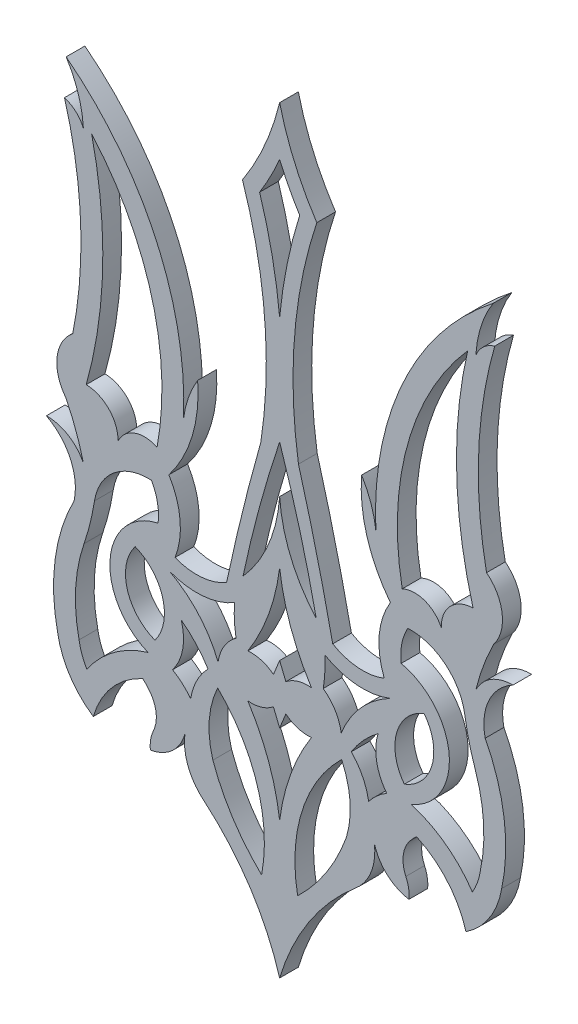
from build123d import *

# Parameters (mm, degrees)
EXTRUDE_1_DEPTH     = 6
CUT_EXTRUDE_4_DEPTH = 10
SCALE_1_SCALE       = 0.5


with BuildPart() as part:
    # Эскиз3 → Бобышка-Вытянуть1 (new body)
    with BuildSketch(Plane.XY):
        with BuildLine():
            ThreePointArc((75.737298173, 214.827117189), (82.873597213, 227.992034462), (87.644341315, 242.186463353))
            ThreePointArc((87.644341315, 242.186463353), (92.415085417, 227.992034462), (99.551384458, 214.827117189))
            ThreePointArc((99.551384458, 214.827117189), (92.448615199, 180.200274987), (93.683201055, 144.874033612))
            ThreePointArc((93.683201055, 144.874033612), (99.543941176, 122.77181273), (104.650975019, 100.483370703))
            ThreePointArc((104.650975019, 100.483370703), (112.761124808, 97.943619496), (121.169223706, 99.180041243))
            ThreePointArc((121.169223706, 99.180041243), (119.549894236, 110.406048742), (123.14170404, 121.164504703))
            ThreePointArc((123.14170404, 121.164504703), (115.644359384, 135.701433483), (113.915816321, 151.966261))
            ThreePointArc((113.915816321, 151.966261), (116.901405678, 145.64272451), (118.481996173, 138.830779763))
            ThreePointArc((118.481996173, 138.830779763), (127.24668609, 184.362661976), (156.055436754, 220.69485118))
            ThreePointArc((156.055436754, 220.69485118), (152.204137163, 212.503983736), (150.529344239, 203.609160148))
            ThreePointArc((150.529344239, 203.609160148), (152.949885488, 207.021489641), (156.580265974, 209.100756347))
            ThreePointArc((156.580265974, 209.100756347), (151.4198282, 177.15256964), (153.948768597, 144.889259016))
            ThreePointArc((153.948768597, 144.889259016), (158.962764238, 135.949313763), (156.186698644, 126.082387532))
            ThreePointArc((156.186698644, 126.082387532), (152.918092332, 118.533010155), (150.508133779, 110.667326092))
            ThreePointArc((150.508133779, 110.667326092), (155.402709379, 116.006658411), (162.390479703, 117.913594648))
            ThreePointArc((162.390479703, 117.913594648), (154.707516768, 109.824907217), (153.507722785, 98.733681937))
            ThreePointArc((153.507722785, 98.733681937), (159.570043449, 79.653195004), (158.80328853, 59.647475814))
            ThreePointArc((158.80328853, 59.647475814), (154.917566842, 49.613113406), (147.358546899, 41.95488388))
            ThreePointArc((147.358546899, 41.95488388), (141.45972495, 52.906488134), (131.532504975, 60.402089491))
            ThreePointArc((131.532504975, 60.402089491), (130.313453485, 59.224360677), (129.217982636, 57.930886552))
            ThreePointArc((129.217982636, 57.930886552), (127.222488275, 52.953447096), (128.085354098, 47.660776328))
            ThreePointArc((128.085354098, 47.660776328), (128.974997774, 44.792014096), (129.083146931, 41.790420124))
            ThreePointArc((129.083146931, 41.790420124), (122.02961795, 45.187826335), (117.983840441, 51.890536563))
            ThreePointArc((117.983840441, 51.890536563), (116.942345618, 43.244180813), (111.79351299, 36.220385415))
            ThreePointArc((111.79351299, 36.220385415), (97.034028223, 19.487966284), (87.644341315, -0.751846469))
            ThreePointArc((87.644341315, -0.751846469), (78.254654407, 19.487966284), (63.495169641, 36.220385415))
            ThreePointArc((63.495169641, 36.220385415), (58.346337012, 43.244180813), (57.30484219, 51.890536563))
            ThreePointArc((57.30484219, 51.890536563), (53.25906468, 45.187826335), (46.205535699, 41.790420124))
            ThreePointArc((46.205535699, 41.790420124), (46.313684857, 44.792014096), (47.203328533, 47.660776328))
            ThreePointArc((47.203328533, 47.660776328), (48.066194355, 52.953447096), (46.070699995, 57.930886552))
            ThreePointArc((46.070699995, 57.930886552), (44.975229145, 59.224360677), (43.756177656, 60.402089491))
            ThreePointArc((43.756177656, 60.402089491), (33.828957681, 52.906488134), (27.930135731, 41.95488388))
            ThreePointArc((27.930135731, 41.95488388), (20.371115788, 49.613113406), (16.4853941, 59.647475814))
            ThreePointArc((16.4853941, 59.647475814), (15.718639182, 79.653195004), (21.780959845, 98.733681937))
            ThreePointArc((21.780959845, 98.733681937), (20.581165862, 109.824907217), (12.898202928, 117.913594648))
            ThreePointArc((12.898202928, 117.913594648), (19.885973252, 116.006658411), (24.780548852, 110.667326092))
            ThreePointArc((24.780548852, 110.667326092), (22.370590299, 118.533010155), (19.101983986, 126.082387532))
            ThreePointArc((19.101983986, 126.082387532), (16.325918393, 135.949313763), (21.339914033, 144.889259016))
            ThreePointArc((21.339914033, 144.889259016), (23.868854431, 177.15256964), (18.708416657, 209.100756347))
            ThreePointArc((18.708416657, 209.100756347), (22.338797143, 207.021489641), (24.759338391, 203.609160148))
            ThreePointArc((24.759338391, 203.609160148), (23.084545467, 212.503983736), (19.233245877, 220.69485118))
            ThreePointArc((19.233245877, 220.69485118), (48.041996541, 184.362661976), (56.806686458, 138.830779763))
            ThreePointArc((56.806686458, 138.830779763), (58.387276952, 145.64272451), (61.37286631, 151.966261))
            ThreePointArc((61.37286631, 151.966261), (59.644323247, 135.701433483), (52.14697859, 121.164504703))
            ThreePointArc((52.14697859, 121.164504703), (55.738788395, 110.406048742), (54.119458925, 99.180041243))
            ThreePointArc((54.119458925, 99.180041243), (62.527557822, 97.943619496), (70.637707612, 100.483370703))
            ThreePointArc((70.637707612, 100.483370703), (75.744741455, 122.77181273), (81.605481576, 144.874033612))
            ThreePointArc((81.605481576, 144.874033612), (82.840067432, 180.200274987), (75.737298173, 214.827117189))
        make_face()
    extrude(amount=EXTRUDE_1_DEPTH)

    # Эскиз4 → Вырез-Вытянуть4 (cut)
    with BuildSketch(Plane.XY):
        with BuildLine():
            Line((85.654622356, 73.518555252), (87.644341315, 68.631836287))
            Line((87.644341315, 68.631836287), (89.634060275, 73.518555252))
            ThreePointArc((89.634060275, 73.518555252), (93.498316524, 71.48652915), (97.84617103, 71.089329421))
            ThreePointArc((97.84617103, 71.089329421), (91.177891627, 57.600515287), (87.644341315, 42.974234859))
            ThreePointArc((87.644341315, 42.974234859), (84.110791004, 57.600515287), (77.442511601, 71.089329421))
            ThreePointArc((77.442511601, 71.089329421), (81.790366107, 71.48652915), (85.654622356, 73.518555252))
        make_face()
        with BuildLine():
            Line((87.644341315, 87.368163713), (89.634060275, 82.481444748))
            ThreePointArc((89.634060275, 82.481444748), (93.498316524, 84.51347085), (97.84617103, 84.910670579))
            ThreePointArc((97.84617103, 84.910670579), (91.177891627, 98.399484713), (87.644341315, 113.025765141))
            ThreePointArc((87.644341315, 113.025765141), (84.110791004, 98.399484713), (77.442511601, 84.910670579))
            ThreePointArc((77.442511601, 84.910670579), (81.790366107, 84.51347085), (85.654622356, 82.481444748))
            Line((85.654622356, 82.481444748), (87.644341315, 87.368163713))
        make_face()
        with BuildLine():
            ThreePointArc((87.644341315, 148.003447902), (81.149794041, 126.61690118), (75.910198282, 104.888805053))
            ThreePointArc((75.910198282, 104.888805053), (84.118417763, 117.892428675), (87.644341315, 132.860292833))
            ThreePointArc((87.644341315, 132.860292833), (91.170264867, 117.892428675), (99.378484349, 104.888805053))
            ThreePointArc((99.378484349, 104.888805053), (94.138888589, 126.61690118), (87.644341315, 148.003447902))
        make_face()
        with BuildLine():
            ThreePointArc((67.78082661, 69.825446008), (80.476833117, 49.16569034), (81.871403931, 24.956823002))
            ThreePointArc((81.871403931, 24.956823002), (72.654345055, 36.068206288), (66.24306766, 49.003140961))
            ThreePointArc((66.24306766, 49.003140961), (65.085086418, 59.556595084), (67.78082661, 69.825446008))
        make_face()
        with BuildLine():
            ThreePointArc((64.682165911, 73.518555252), (60.834261147, 78.585776038), (56.108384596, 82.845962464))
            ThreePointArc((56.108384596, 82.845962464), (56.577504562, 74.908677344), (53.334779442, 67.648835581))
            ThreePointArc((53.334779442, 67.648835581), (56.48094396, 65.35561463), (59.118823877, 62.492259422))
            ThreePointArc((59.118823877, 62.492259422), (61.041725308, 68.438701437), (64.682165911, 73.518555252))
        make_face()
        with BuildLine():
            ThreePointArc((67.908044121, 77.068549767), (61.672372831, 87.192623316), (52.307890576, 94.519760123))
            ThreePointArc((52.307890576, 94.519760123), (62.92084749, 92.959111172), (73.157724023, 96.164862015))
            ThreePointArc((73.157724023, 96.164862015), (73.141858231, 91.35681801), (73.672035417, 86.578068066))
            ThreePointArc((73.672035417, 86.578068066), (69.829998601, 82.405217354), (67.908044121, 77.068549767))
        make_face()
        with BuildLine():
            ThreePointArc((41.355166098, 95.816406993), (50.176134503, 85.986630032), (47.690712162, 73.01525098))
            ThreePointArc((47.690712162, 73.01525098), (38.779973269, 82.820084247), (41.355166098, 95.816406993))
        make_face()
        with BuildLine():
            ThreePointArc((133.933516533, 95.816406993), (136.508709361, 82.820084247), (127.597970468, 73.01525098))
            ThreePointArc((127.597970468, 73.01525098), (125.112548128, 85.986630032), (133.933516533, 95.816406993))
        make_face()
        with BuildLine():
            ThreePointArc((101.616647213, 86.578068066), (102.1468244, 91.35681801), (102.130958608, 96.164862015))
            ThreePointArc((102.130958608, 96.164862015), (112.36783514, 92.959111172), (122.980792054, 94.519760123))
            ThreePointArc((122.980792054, 94.519760123), (113.6163098, 87.192623316), (107.38063851, 77.068549767))
            ThreePointArc((107.38063851, 77.068549767), (105.45868403, 82.405217354), (101.616647213, 86.578068066))
        make_face()
        with BuildLine():
            ThreePointArc((116.169858754, 62.492259422), (118.807738671, 65.35561463), (121.953903189, 67.648835581))
            ThreePointArc((121.953903189, 67.648835581), (118.711178069, 74.908677344), (119.180298034, 82.845962464))
            ThreePointArc((119.180298034, 82.845962464), (114.454421483, 78.585776038), (110.60651672, 73.518555252))
            ThreePointArc((110.60651672, 73.518555252), (114.246957322, 68.438701437), (116.169858754, 62.492259422))
        make_face()
        with BuildLine():
            ThreePointArc((109.045614971, 49.003140961), (110.203596213, 59.556595084), (107.507856021, 69.825446008))
            ThreePointArc((107.507856021, 69.825446008), (94.811849514, 49.16569034), (93.417278699, 24.956823002))
            ThreePointArc((93.417278699, 24.956823002), (102.634337575, 36.068206288), (109.045614971, 49.003140961))
        make_face()
        with BuildLine():
            ThreePointArc((46.570080759, 116.846320473), (34.595716893, 112.920248845), (28.316429178, 101.994592151))
            ThreePointArc((28.316429178, 101.994592151), (26.9333239, 95.142193412), (24.957292002, 88.436699647))
            ThreePointArc((24.957292002, 88.436699647), (22.277621632, 74.801992121), (23.365701976, 60.94912369))
            ThreePointArc((23.365701976, 60.94912369), (24.292977573, 57.352257012), (25.886565586, 53.996997383))
            ThreePointArc((25.886565586, 53.996997383), (34.413462447, 62.958528928), (45.462301972, 68.520917162))
            ThreePointArc((45.462301972, 68.520917162), (33.315609183, 88.459157063), (48.700428736, 106.019990853))
            ThreePointArc((48.700428736, 106.019990853), (48.506236595, 111.604542872), (46.570080759, 116.846320473))
        make_face()
        with BuildLine():
            ThreePointArc((151.922980655, 60.94912369), (150.995705058, 57.352257012), (149.402117045, 53.996997383))
            ThreePointArc((149.402117045, 53.996997383), (140.875220183, 62.958528928), (129.826380659, 68.520917162))
            ThreePointArc((129.826380659, 68.520917162), (141.973073448, 88.459157063), (126.588253895, 106.019990853))
            ThreePointArc((126.588253895, 106.019990853), (126.782446036, 111.604542872), (128.718601872, 116.846320473))
            ThreePointArc((128.718601872, 116.846320473), (140.692965737, 112.920248845), (146.972253453, 101.994592151))
            ThreePointArc((146.972253453, 101.994592151), (148.355358731, 95.142193412), (150.331390628, 88.436699647))
            ThreePointArc((150.331390628, 88.436699647), (153.011060999, 74.801992121), (151.922980655, 60.94912369))
        make_face()
        with BuildLine():
            ThreePointArc((48.355392718, 126.900367718), (46.714086351, 167.601052005), (27.386922462, 203.457715599))
            ThreePointArc((27.386922462, 203.457715599), (30.940238269, 168.082502681), (25.662297387, 132.923221086))
            ThreePointArc((25.662297387, 132.923221086), (32.940011964, 129.766489423), (35.853986928, 122.388221729))
            ThreePointArc((35.853986928, 122.388221729), (41.170193791, 127.233420637), (48.355392718, 126.900367718))
        make_face()
        with BuildLine():
            ThreePointArc((139.434695702, 122.388221729), (134.11848884, 127.233420637), (126.933289913, 126.900367718))
            ThreePointArc((126.933289913, 126.900367718), (128.57459628, 167.601052005), (147.901760168, 203.457715599))
            ThreePointArc((147.901760168, 203.457715599), (144.348444361, 168.082502681), (149.626385244, 132.923221086))
            ThreePointArc((149.626385244, 132.923221086), (142.348670666, 129.766489423), (139.434695702, 122.388221729))
        make_face()
        with BuildLine():
            ThreePointArc((94.066919651, 214.119894368), (90.031739471, 198.523177696), (87.644341315, 182.590802479))
            ThreePointArc((87.644341315, 182.590802479), (85.25694316, 198.523177696), (81.22176298, 214.119894368))
            ThreePointArc((81.22176298, 214.119894368), (84.665732339, 220.152220055), (87.644341315, 226.427390706))
            ThreePointArc((87.644341315, 226.427390706), (90.622950292, 220.152220055), (94.066919651, 214.119894368))
        make_face()
    extrude(amount=CUT_EXTRUDE_4_DEPTH, mode=Mode.SUBTRACT)


with BuildPart() as part_1:
    # Масштаб1: scaled about (87.644341315, 110.400596094, 3)
    add(part.part.scale(SCALE_1_SCALE).moved(Location((43.822170658, 55.200298047, 1.5))))


solid = part_1.part
